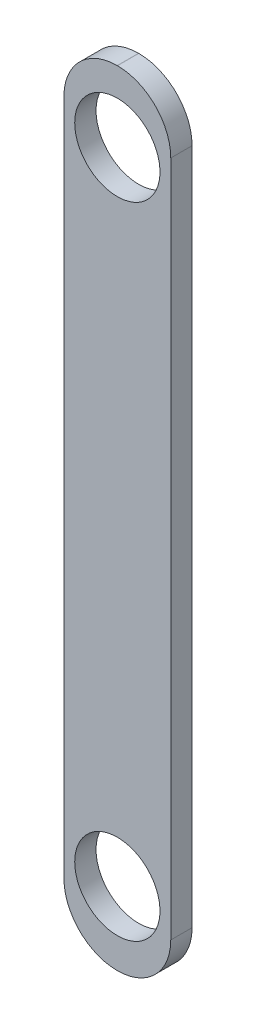
from build123d import *

# Parameters (mm, degrees)
SKETCH_1_W          = 25.05955055
SKETCH_1_H          = 183.842173556
EXTRUDE_1_DEPTH     = 5
SKETCH_2_R          = 10
CUT_EXTRUDE_1_DEPTH = 5
FILLET_1_R          = 12.5


with BuildPart() as part:
    # 草图1 → 凸台-拉伸1 (new body)
    with BuildSketch(Plane.XY):
        Rectangle(SKETCH_1_W, SKETCH_1_H)
    extrude(amount=EXTRUDE_1_DEPTH)

    # 草图2 → 切除-拉伸1 (cut)
    with BuildSketch(Plane(origin=(0, 0, 0), x_dir=(-1, 0, 0), z_dir=(0, 0, -1))):
        with Locations((0, 75.312469171)):
            Circle(SKETCH_2_R)
        with Locations((0, -74.807016358)):
            Circle(SKETCH_2_R)
    extrude(amount=-CUT_EXTRUDE_1_DEPTH, mode=Mode.SUBTRACT)

    # 圆角1
    fillet_1_edges = [part.edges().sort_by_distance(p)[0] for p in [
        (-12.529775275, 91.921086778, 2.5),
        (12.529775275, 91.921086778, 2.5),
        (12.529775275, -91.921086778, 2.5),
        (-12.529775275, -91.921086778, 2.5),
    ]]
    fillet(fillet_1_edges, radius=FILLET_1_R)


solid = part.part
